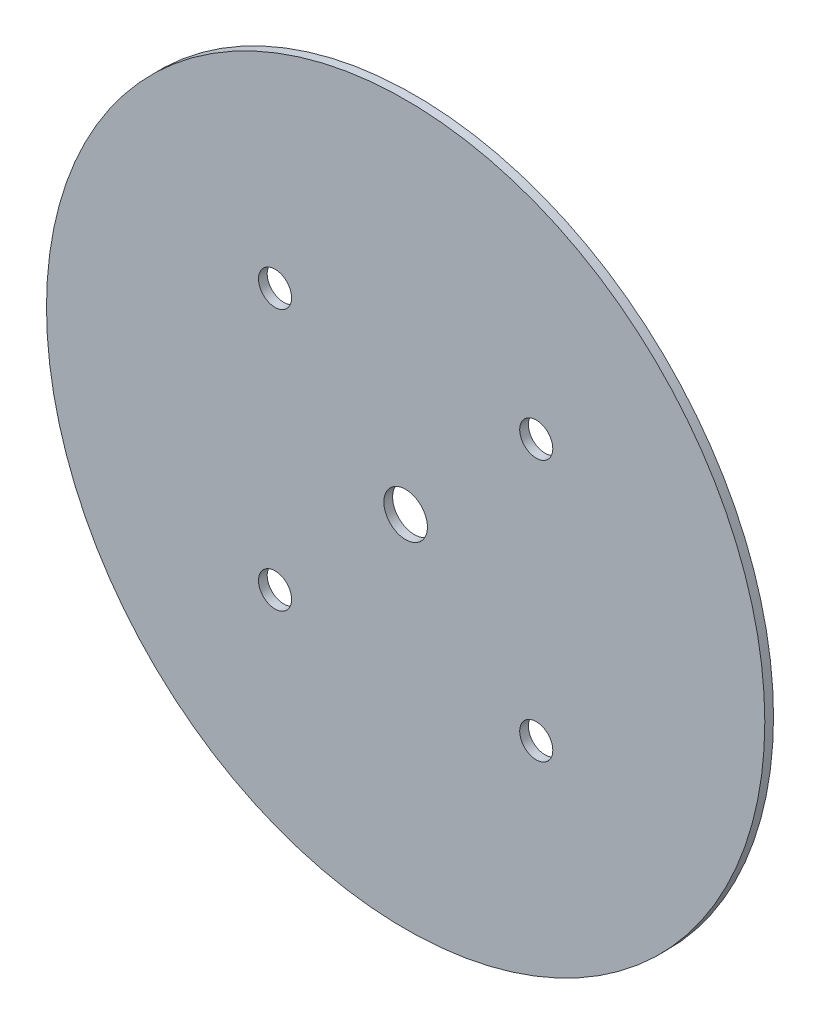
from build123d import *

# Parameters (mm, degrees)
SKETCH_1_R          = 82.5
EXTRUDE_1_DEPTH     = 2
SKETCH_2_R          = 3.8
SKETCH_2_R_2        = 5
CUT_EXTRUDE_1_DEPTH = 117.689759619


with BuildPart() as part:
    # 草图1 → 凸台-拉伸1 (new body)
    with BuildSketch(Plane.XY):
        Circle(SKETCH_1_R)
    extrude(amount=EXTRUDE_1_DEPTH)

    # 草图2 → 切除-拉伸1 (cut, through all)
    with BuildSketch(Plane.XY.offset(2)):
        with Locations((30, 30)):
            Circle(SKETCH_2_R)
        with Locations((-30, 30)):
            Circle(SKETCH_2_R)
        with Locations((-30, -30)):
            Circle(SKETCH_2_R)
        with Locations((30, -30)):
            Circle(SKETCH_2_R)
        Circle(SKETCH_2_R_2)
    extrude(amount=-CUT_EXTRUDE_1_DEPTH, mode=Mode.SUBTRACT)


solid = part.part
